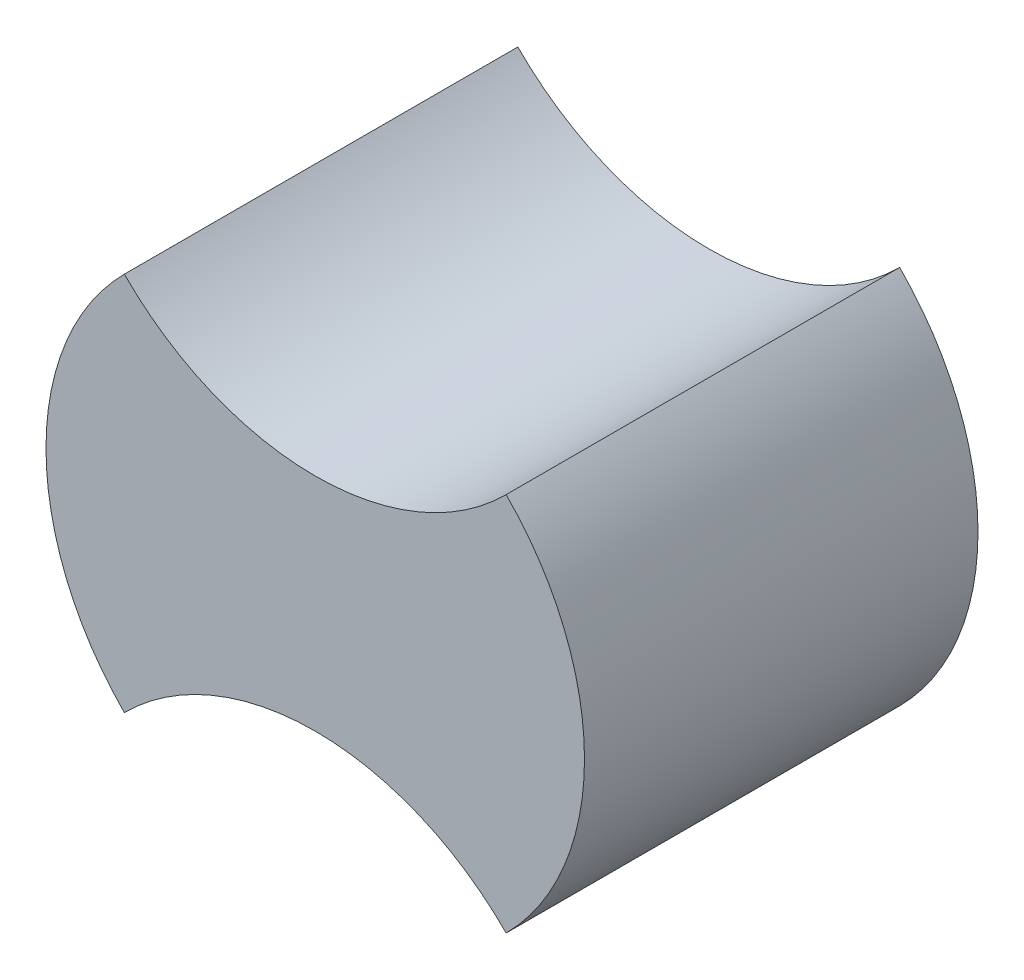
from build123d import *

# Parameters (mm, degrees)
BOSS_EXTRUDE1_DEPTH = 57
CUT_EXTRUDE1_DEPTH  = 3


with BuildPart() as part:
    # Sketch1 → Boss-Extrude1 (new body)
    with BuildSketch(Plane.XY):
        with BuildLine():
            ThreePointArc((-27.654113618, 27.5), (-39, 0), (-27.654113618, -27.5))
            ThreePointArc((-27.654113618, -27.5), (0, -16), (27.654113618, -27.5))
            ThreePointArc((27.654113618, -27.5), (39, 0), (27.654113618, 27.5))
            ThreePointArc((27.654113618, 27.5), (0, 16), (-27.654113618, 27.5))
        make_face()
    extrude(amount=BOSS_EXTRUDE1_DEPTH)

    # Sketch2 → Cut-Extrude1 (cut)
    with BuildSketch(Plane(origin=(0, 0, 0), x_dir=(-1, 0, 0), z_dir=(0, 0, -1))):
        with BuildLine():
            Line((16, 2), (1.524617098, 5.803063217))
            ThreePointArc((1.524617098, 5.803063217), (0, 6), (-1.524617098, 5.803063217))
            Line((-1.524617098, 5.803063217), (-16, 2))
            ThreePointArc((-16, 2), (-18, 0), (-16, -2))
            Line((-16, -2), (-1.524617098, -5.803063217))
            ThreePointArc((-1.524617098, -5.803063217), (0, -6), (1.524617098, -5.803063217))
            Line((1.524617098, -5.803063217), (16, -2))
            ThreePointArc((16, -2), (18, 0), (16, 2))
        make_face()
    extrude(amount=-CUT_EXTRUDE1_DEPTH, mode=Mode.SUBTRACT)


solid = part.part
